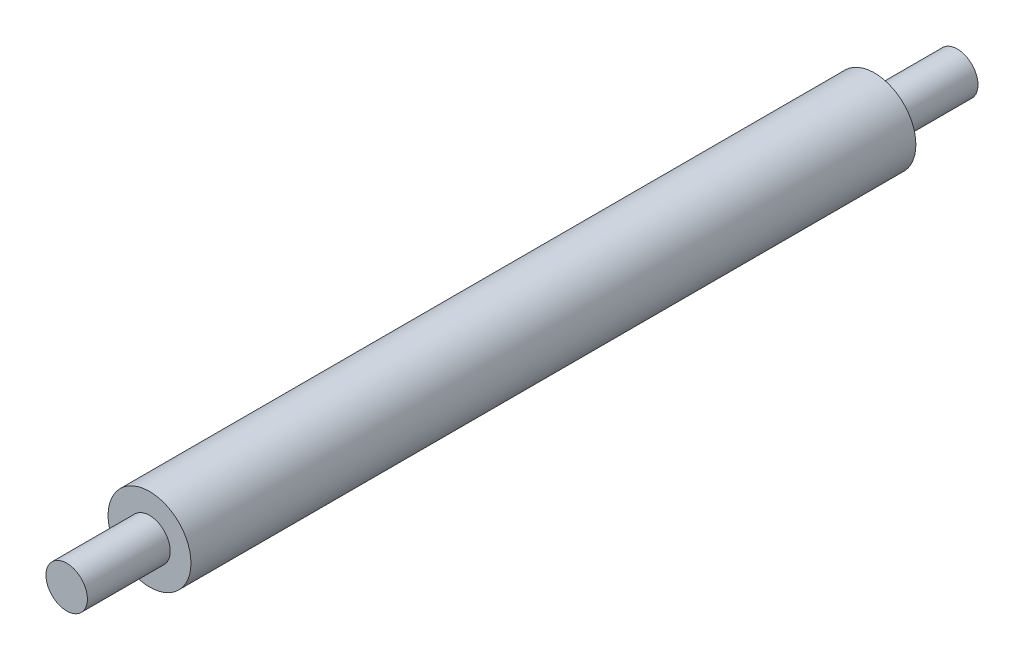
from build123d import *

# Parameters (mm, degrees)
SKETCH1_R           = 10
BOSS_EXTRUDE1_DEPTH = 87.5
SKETCH2_R           = 5
BOSS_EXTRUDE2_DEPTH = 20


with BuildPart() as part:
    # Sketch1 → Boss-Extrude1 (new, symmetric)
    with BuildSketch(Plane.XY):
        Circle(SKETCH1_R)
    extrude(amount=BOSS_EXTRUDE1_DEPTH, both=True)

    # Sketch2 → Boss-Extrude2 (add)
    with BuildSketch(Plane.XY.offset(87.5)):
        Circle(SKETCH2_R)
    boss_extrude2 = extrude(amount=BOSS_EXTRUDE2_DEPTH)

    # Mirror1: Boss-Extrude2 across plane
    add(boss_extrude2.mirror(Plane.XY))


solid = part.part
